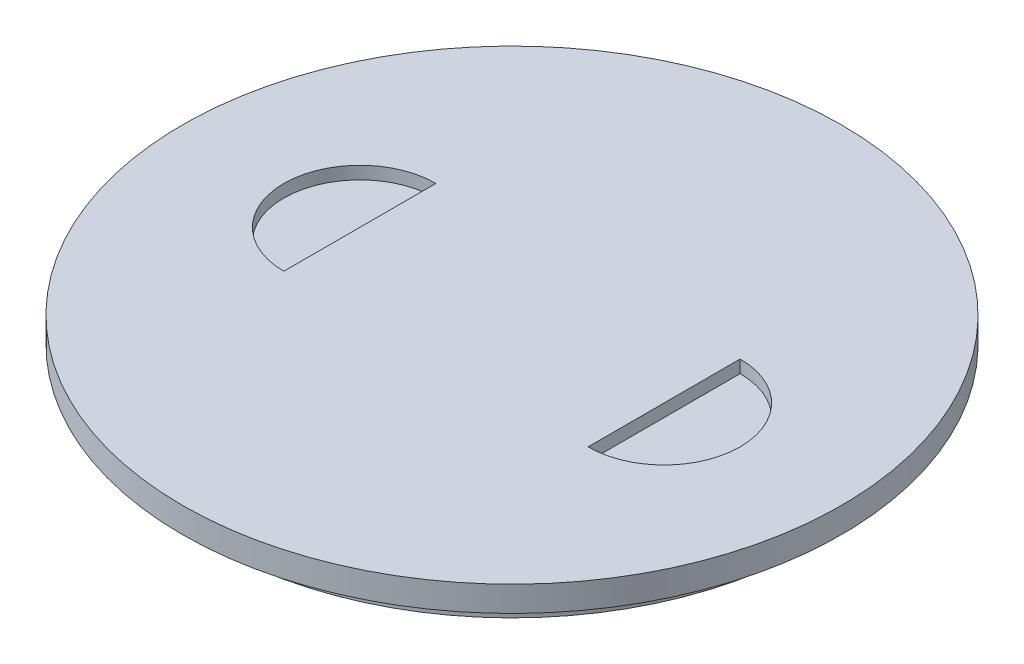
from build123d import *

# Parameters (mm, degrees)
SKETCH1_R           = 82.55
BOSS_EXTRUDE2_DEPTH = 6.35
SKETCH1_4_R         = 74.93
SKETCH1_4_R_2       = 69.85
BOSS_EXTRUDE3_DEPTH = 6.35
CUT_EXTRUDE1_DEPTH  = 3.175


with BuildPart() as part:
    # Sketch1 → Boss-Extrude2 (new body)
    with BuildSketch(Plane(origin=(0, 0, 0), x_dir=(1, 0, 0), z_dir=(0, 1, 0))):
        Circle(SKETCH1_R)
    extrude(amount=BOSS_EXTRUDE2_DEPTH)

    # Sketch1<4> → Boss-Extrude3 (add)
    with BuildSketch(Plane(origin=(0, 0, 0), x_dir=(1, 0, 0), z_dir=(0, 1, 0))):
        Circle(SKETCH1_4_R)
        Circle(SKETCH1_4_R_2, mode=Mode.SUBTRACT)
    extrude(amount=-BOSS_EXTRUDE3_DEPTH)

    # Sketch2 → Cut-Extrude1 (cut)
    with BuildSketch(Plane(origin=(0, 6.35, 0), x_dir=(1, 0, 0), z_dir=(0, 1, 0))):
        with BuildLine():
            Line((-38.1, 19.05), (-38.1, -19.05))
            ThreePointArc((-38.1, -19.05), (-57.15, 0), (-38.1, 19.05))
        make_face()
        with BuildLine():
            Line((38.1, 19.05), (38.1, -19.05))
            ThreePointArc((38.1, -19.05), (57.15, 0), (38.1, 19.05))
        make_face()
    extrude(amount=-CUT_EXTRUDE1_DEPTH, mode=Mode.SUBTRACT)


solid = part.part
